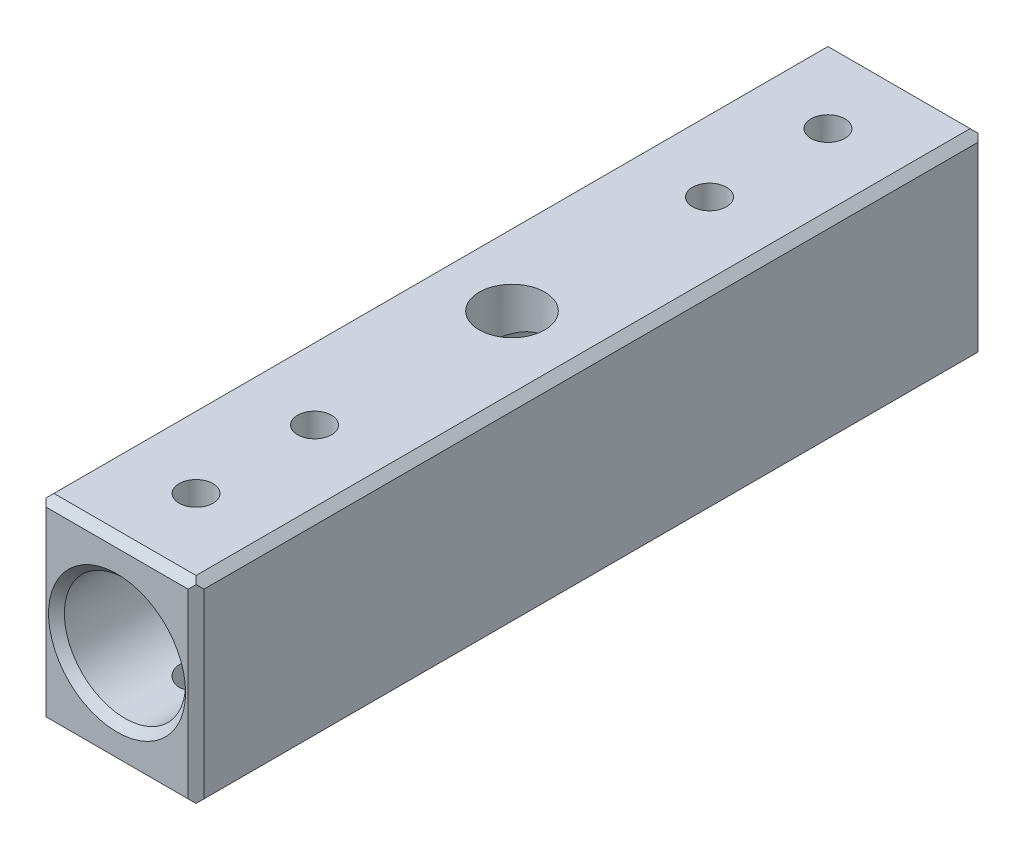
from build123d import *

# Parameters (mm, degrees)
SKETCH_2_W          = 20
SKETCH_2_H          = 25
SKETCH_2_R          = 7.675
EXTRUDE_1_DEPTH     = 100
SKETCH_3_R          = 2.15
SKETCH_3_R_2        = 4.15
CUT_EXTRUDE_2_DEPTH = 104.561575886
CHAMFER_1_SIZE      = 1
CHAMFER_2_SIZE      = 1


with BuildPart() as part:
    # 草图2 → 凸台-拉伸1 (new body)
    with BuildSketch(Plane.XY):
        Rectangle(SKETCH_2_W, SKETCH_2_H)
        Circle(SKETCH_2_R, mode=Mode.SUBTRACT)
    extrude(amount=-EXTRUDE_1_DEPTH)

    # 草图3 → 切除-拉伸2 (cut, through all)
    with BuildSketch(Plane(origin=(0, 12.5, 0), x_dir=(1, 0, 0), z_dir=(0, 1, 0))):
        with Locations((0, 75)):
            Circle(SKETCH_3_R)
        with Locations((0, 50)):
            Circle(SKETCH_3_R_2)
        with Locations((0, 90)):
            Circle(SKETCH_3_R)
        with Locations((0, 10)):
            Circle(SKETCH_3_R)
        with Locations((0, 25)):
            Circle(SKETCH_3_R)
    extrude(amount=-CUT_EXTRUDE_2_DEPTH, mode=Mode.SUBTRACT)

    # 倒角1
    chamfer_1_edges = [part.edges().sort_by_distance(p)[0] for p in [
        (0, 12.5, -100),
        (-10, 0, -100),
        (0, -12.5, -100),
        (10, 0, -100),
        (0, -12.5, 0),
        (-10, 0, 0),
        (0, 12.5, 0),
        (10, 0, 0),
        (-7.675, 0, -100),
        (-7.675, 0, 0),
    ]]
    chamfer(chamfer_1_edges, length=CHAMFER_1_SIZE)

    # 倒角2
    chamfer_2_edges = [part.edges().sort_by_distance(p)[0] for p in [
        (10, -12.5, -50),
        (-10, -12.5, -50),
        (10, 12.5, -50),
        (-10, 12.5, -50),
    ]]
    chamfer(chamfer_2_edges, length=CHAMFER_2_SIZE)


solid = part.part
